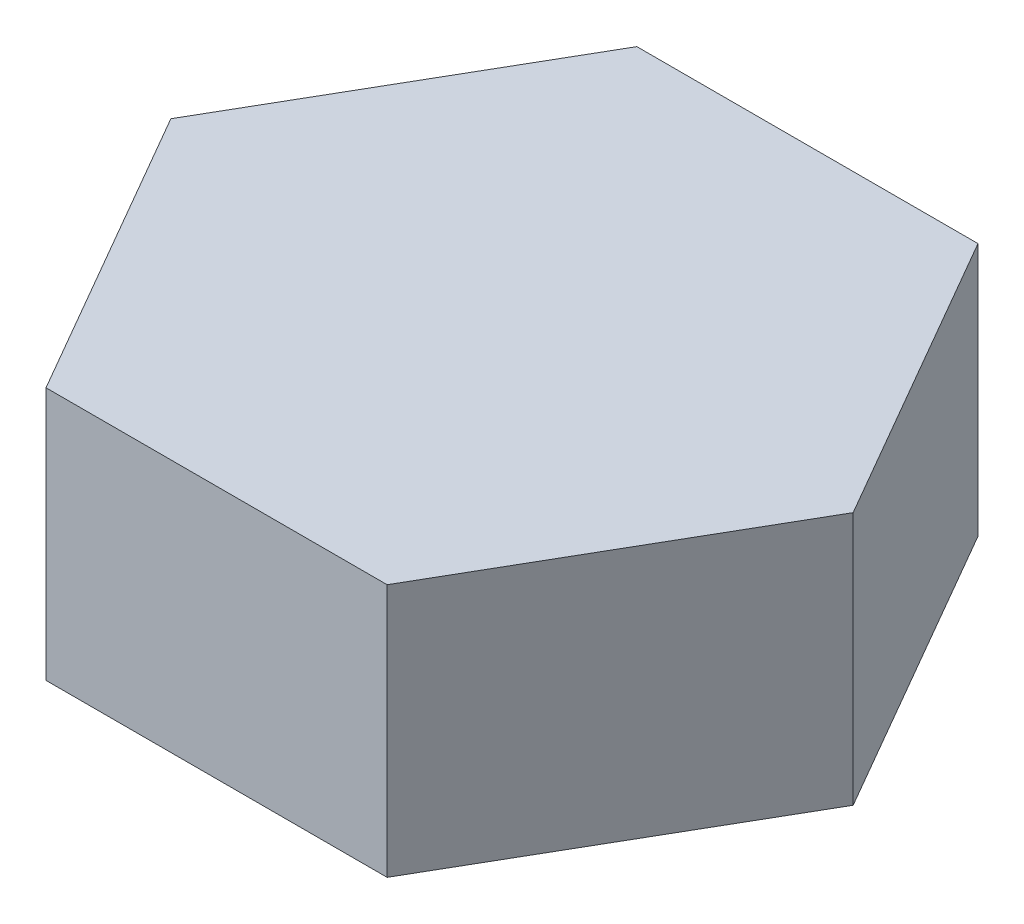
from build123d import *

# Parameters (mm, degrees)
BOSS_EXTRUDE1_DEPTH = 30


with BuildPart() as part:
    # Sketch1 → Boss-Extrude1 (new body)
    with BuildSketch(Plane(origin=(0, 0, 0), x_dir=(1, 0, 0), z_dir=(0, 1, 0))):
        Polygon((-40.379877827, 0), (-20.189938914, -34.97), (20.189938914, -34.97), (40.379877827, 0), (20.189938914, 34.97), (-20.189938914, 34.97), align=None)
    extrude(amount=BOSS_EXTRUDE1_DEPTH)


solid = part.part
